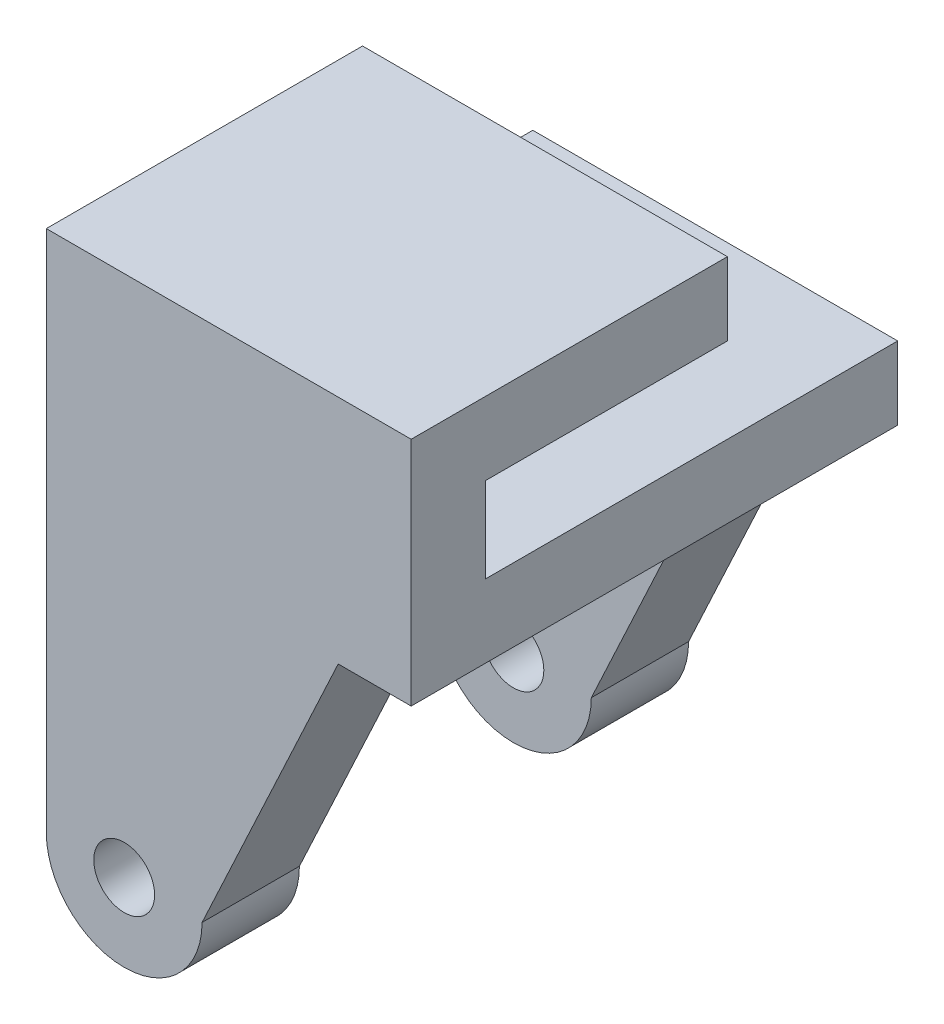
from build123d import *

# Parameters (mm, degrees)
SKETCH1_W               = 20
SKETCH1_H               = 9.5
BOSS_EXTRUDE1_DEPTH     = 15
CUT_EXTRUDE1_DEPTH      = 27.744158241
CUT_EXTRUDE1_DEPTH_BACK = 27.744158241
SKETCH4_R               = 1.25
BOSS_EXTRUDE3_DEPTH     = 4


with BuildPart() as part:
    # Sketch1 → Boss-Extrude1 (new body)
    with BuildSketch(Plane(origin=(0, 0, 0), x_dir=(0, 0, -1), z_dir=(1, 0, 0))):
        with Locations((10, 4.75)):
            Rectangle(SKETCH1_W, SKETCH1_H)
    extrude(amount=BOSS_EXTRUDE1_DEPTH)

    # Sketch2 → Cut-Extrude1 (cut, two sides: drawn at the far end of the back side and taken through both)
    with BuildSketch(Plane(origin=(15, 0, 0), x_dir=(0, 0, -1), z_dir=(1, 0, 0)).offset(-CUT_EXTRUDE1_DEPTH_BACK)):
        Polygon((20, 3), (3.047520991, 3), (3.047520991, 6.5), (13, 6.5), (13, 9.5), (20, 9.5), (20, 6.3375), align=None)
    extrude(amount=CUT_EXTRUDE1_DEPTH + CUT_EXTRUDE1_DEPTH_BACK, mode=Mode.SUBTRACT)

    # Sketch4 → Boss-Extrude3 (add)
    with BuildSketch(Plane.XY):
        with BuildLine():
            Line((0, 0), (0, -12))
            ThreePointArc((0, -12), (3.202154051, -15.202154051), (6.404308102, -12))
            Line((6.404308102, -12), (12, 0))
            Line((12, 0), (0, 0))
        make_face()
        with Locations((3.202154051, -12)):
            Circle(SKETCH4_R, mode=Mode.SUBTRACT)
    boss_extrude3 = extrude(amount=-BOSS_EXTRUDE3_DEPTH)

    # Mirror1: Boss-Extrude3 across plane
    add(boss_extrude3.mirror(Plane.XY.offset(-10)))


solid = part.part
